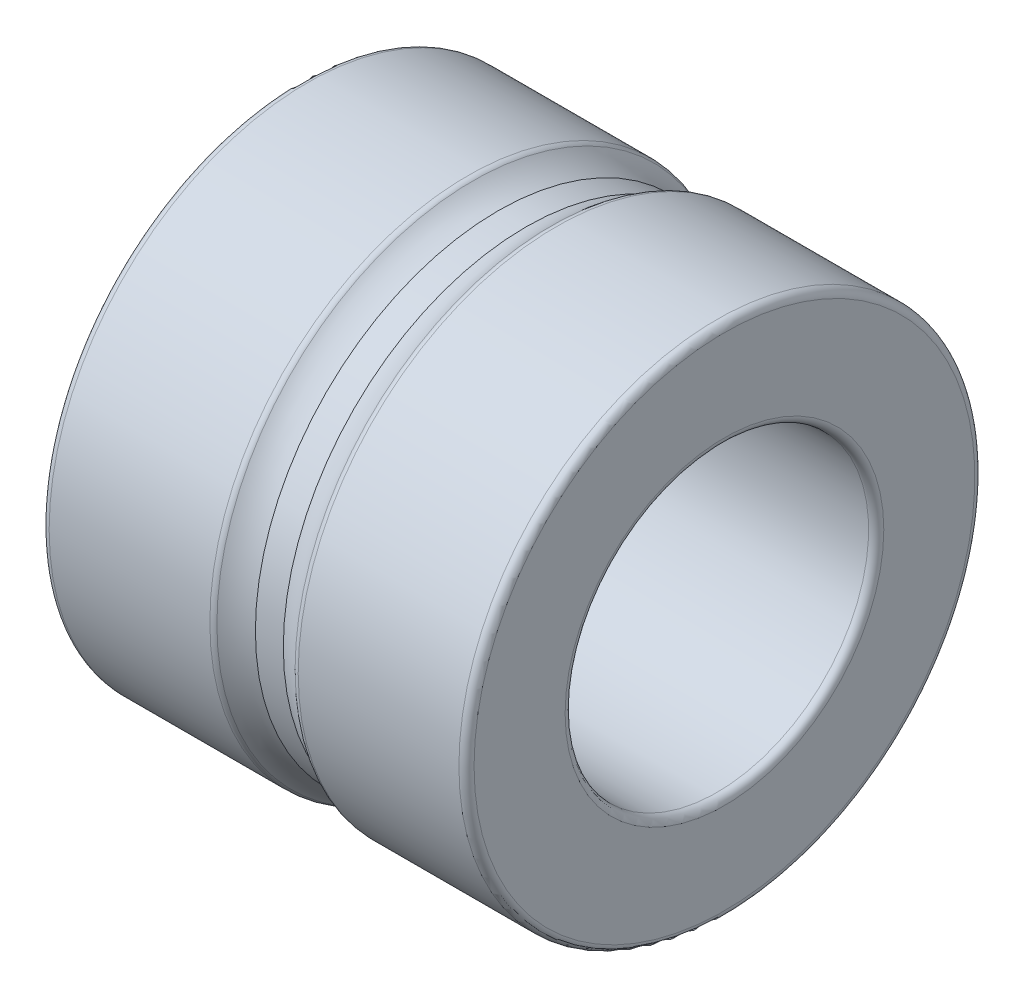
from build123d import *

# Parameters (mm, degrees)
FILLET1_R = 0.25


with BuildPart() as part:
    # Sketch1 → Revolve1 (revolve)
    with BuildSketch(Plane.XY, mode=Mode.PRIVATE) as revolve1_sk:
        with BuildLine():
            Line((0, 5), (14, 5))
            Line((14, 5), (14, 8.5))
            Line((14, 8.5), (8.356206975, 8.5))
            ThreePointArc((8.356206975, 8.5), (7.94255408, 8.186361661), (7.46, 7.995))
            Line((7.46, 7.995), (6.54, 7.995))
            ThreePointArc((6.54, 7.995), (6.05744592, 8.186361661), (5.643793025, 8.5))
            Line((5.643793025, 8.5), (0, 8.5))
            Line((0, 8.5), (0, 5))
        make_face()
    revolve(revolve1_sk.sketch.rotate(Axis((0, 0, 0), (1, 0, 0)), 90), axis=Axis((0, 0, 0), (1, 0, 0)))

    # Fillet1
    fillet1_edges = [part.edges().sort_by_distance(p)[0] for p in [
        (0, 0, -8.5),
        (5.643793025, 0, -8.5),
        (8.356206975, 0, -8.5),
        (14, 0, -8.5),
        (14, 0, -5),
        (0, 0, -5),
    ]]
    fillet(fillet1_edges, radius=FILLET1_R)


solid = part.part
